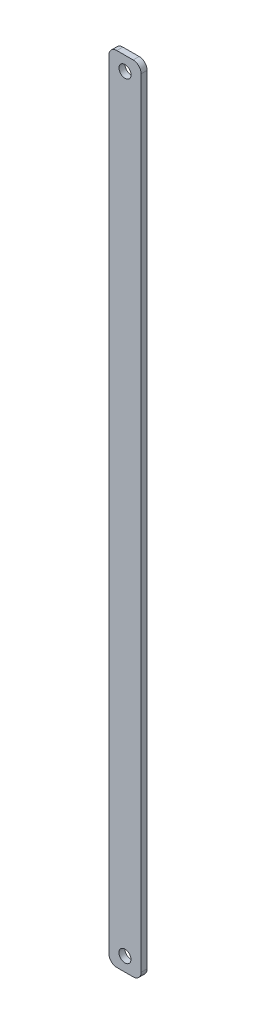
from build123d import *

# Parameters (mm, degrees)
SKETCH1_W           = 8.07
SKETCH1_H           = 1.5
BOSS_EXTRUDE1_DEPTH = 198.5
SKETCH2_R           = 1.5
CUT_EXTRUDE1_DEPTH  = 1.5
FILLET1_R           = 2


with BuildPart() as part:
    # Sketch1 → Boss-Extrude1 (new body)
    with BuildSketch(Plane(origin=(0, 0, 0), x_dir=(1, 0, 0), z_dir=(0, 1, 0))):
        Rectangle(SKETCH1_W, SKETCH1_H)
    extrude(amount=BOSS_EXTRUDE1_DEPTH)

    # Sketch2 → Cut-Extrude1 (cut)
    with BuildSketch(Plane.XY.offset(0.75)):
        with Locations((-0.005, 3.499996429)):
            Circle(SKETCH2_R)
        with Locations((0.005, 195)):
            Circle(SKETCH2_R)
    extrude(amount=-CUT_EXTRUDE1_DEPTH, mode=Mode.SUBTRACT)

    # Fillet1
    fillet1_edges = [part.edges().sort_by_distance(p)[0] for p in [
        (-4.035, 198.5, 0),
        (4.035, 198.5, 0),
        (-4.035, 0, 0),
        (4.035, 0, 0),
    ]]
    fillet(fillet1_edges, radius=FILLET1_R)


solid = part.part
